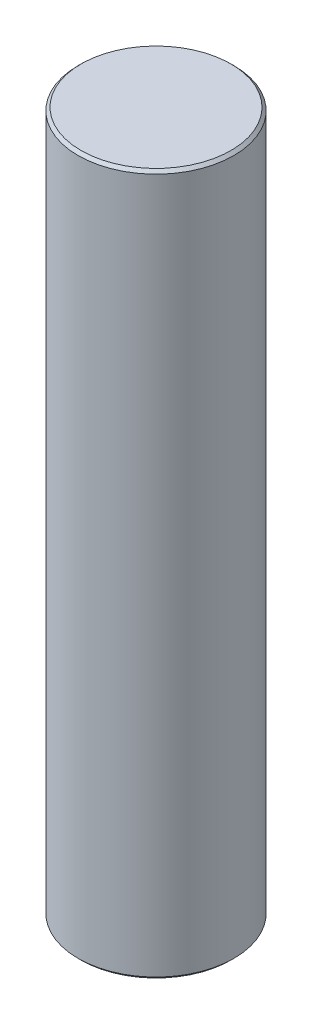
from build123d import *

# Parameters (mm, degrees)
SKETCH1_R           = 4
BOSS_EXTRUDE1_DEPTH = 36
CHAMFER1_SIZE       = 0.15


with BuildPart() as part:
    # Sketch1 → Boss-Extrude1 (new body)
    with BuildSketch(Plane(origin=(0, 0, 0), x_dir=(1, 0, 0), z_dir=(0, 1, 0))):
        with Locations(Location((0, 0, 0), (0, 0, 270))):
            Circle(SKETCH1_R)
    extrude(amount=BOSS_EXTRUDE1_DEPTH)

    # Chamfer1
    chamfer1_edges = [part.edges().sort_by_distance(p)[0] for p in [
        (0, 0, -4),
        (0, 36, -4),
    ]]
    chamfer(chamfer1_edges, length=CHAMFER1_SIZE)


solid = part.part
